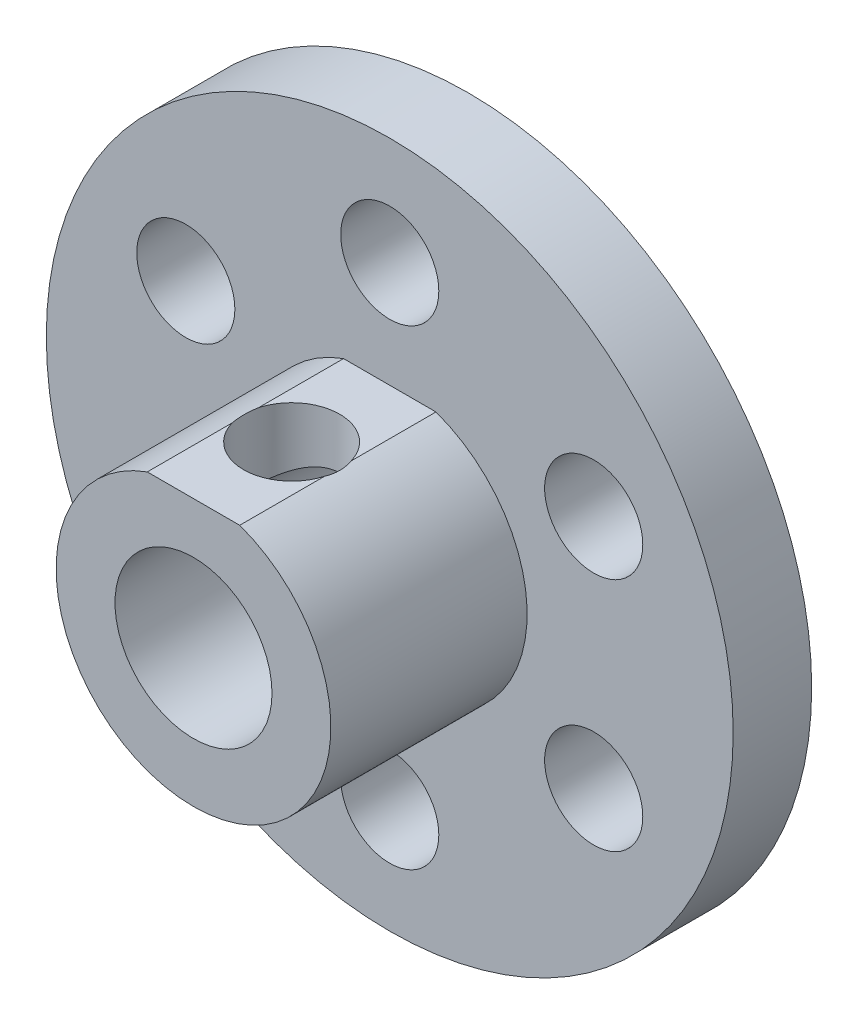
from build123d import *

# Parameters (mm, degrees)
SKETCH1_R           = 17.5
SKETCH1_R_2         = 2.5
SKETCH1_R_3         = 4
BOSS_EXTRUDE1_DEPTH = 4
SKETCH3_R           = 4
BOSS_EXTRUDE2_DEPTH = 10
SKETCH4_R           = 2.45
CUT_EXTRUDE1_DEPTH  = 4


with BuildPart() as part:
    # Sketch1 → Boss-Extrude1 (new body)
    with BuildSketch(Plane.XY):
        Circle(SKETCH1_R)
        with Locations((0, 12)):
            Circle(SKETCH1_R_2, mode=Mode.SUBTRACT)
        with Locations((10.392304845, 6)):
            Circle(SKETCH1_R_2, mode=Mode.SUBTRACT)
        with Locations((10.392304845, -6)):
            Circle(SKETCH1_R_2, mode=Mode.SUBTRACT)
        with Locations((0, -12)):
            Circle(SKETCH1_R_2, mode=Mode.SUBTRACT)
        with Locations((-10.392304845, -6)):
            Circle(SKETCH1_R_2, mode=Mode.SUBTRACT)
        with Locations((-10.392304845, 6)):
            Circle(SKETCH1_R_2, mode=Mode.SUBTRACT)
        Circle(SKETCH1_R_3, mode=Mode.SUBTRACT)
    extrude(amount=BOSS_EXTRUDE1_DEPTH)

    # Sketch3 → Boss-Extrude2 (add)
    with BuildSketch(Plane.XY.offset(4)):
        with BuildLine():
            Line((2.355105774, 6.591925121), (-2.355105774, 6.591925121))
            ThreePointArc((-2.355105774, 6.591925121), (0, -7), (2.355105774, 6.591925121))
        make_face()
        Circle(SKETCH3_R, mode=Mode.SUBTRACT)
    extrude(amount=BOSS_EXTRUDE2_DEPTH)

    # Sketch4 → Cut-Extrude1 (cut)
    with BuildSketch(Plane(origin=(0, 6.591925121, 0), x_dir=(1, 0, 0), z_dir=(0, 1, 0))):
        with Locations(Location((0, -9, 0), (0, 0, 270))):
            Circle(SKETCH4_R)
    extrude(amount=-CUT_EXTRUDE1_DEPTH, mode=Mode.SUBTRACT)


solid = part.part
